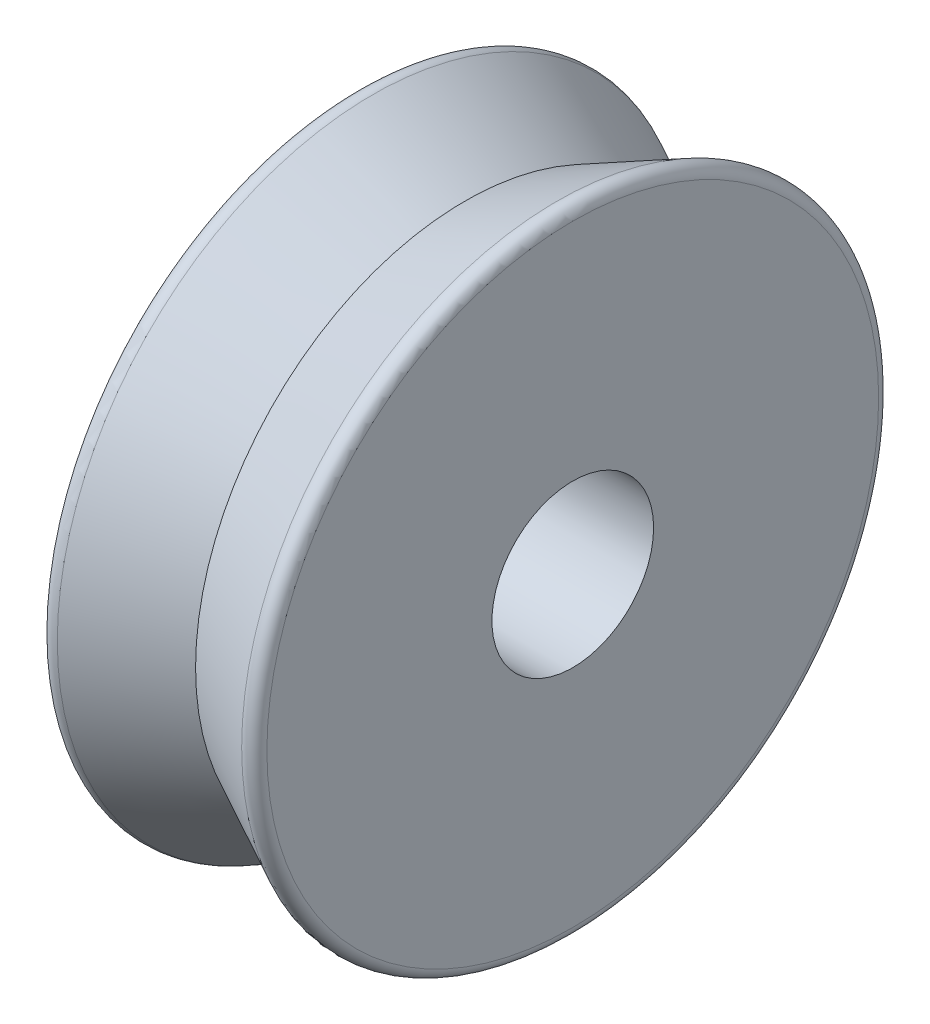
from build123d import *

# Parameters (mm, degrees)
CUT_EXTRUDE1_DEPTH      = 9.717797887
CUT_EXTRUDE1_DEPTH_BACK = 9.717797887
SKETCH2_R               = 1.5
FILLET2_R               = 0.2


with BuildPart() as part:
    # Sketch1 → Revolve1 (revolve)
    with BuildSketch(Plane.XY, mode=Mode.PRIVATE) as revolve1_sk:
        Polygon((0, 5), (-2, 6), (-2, 0), (2, 0), (2, 6), align=None)
    revolve(revolve1_sk.sketch.rotate(Axis((-9.793827425, 0, 0), (1, 0, 0)), 90), axis=Axis((-9.793827425, 0, 0), (1, 0, 0)))

    # Sketch2 → Cut-Extrude1 (cut, two sides: drawn at the far end of the back side and taken through both)
    with BuildSketch(Plane(origin=(0, 0, 0), x_dir=(0, 0, -1), z_dir=(1, 0, 0)).offset(-CUT_EXTRUDE1_DEPTH_BACK)):
        Circle(SKETCH2_R)
    extrude(amount=CUT_EXTRUDE1_DEPTH + CUT_EXTRUDE1_DEPTH_BACK, mode=Mode.SUBTRACT)

    # Fillet2
    fillet2_edges = [part.edges().sort_by_distance(p)[0] for p in [
        (-2, 0, -6),
        (2, 0, -6),
    ]]
    fillet(fillet2_edges, radius=FILLET2_R)


solid = part.part
